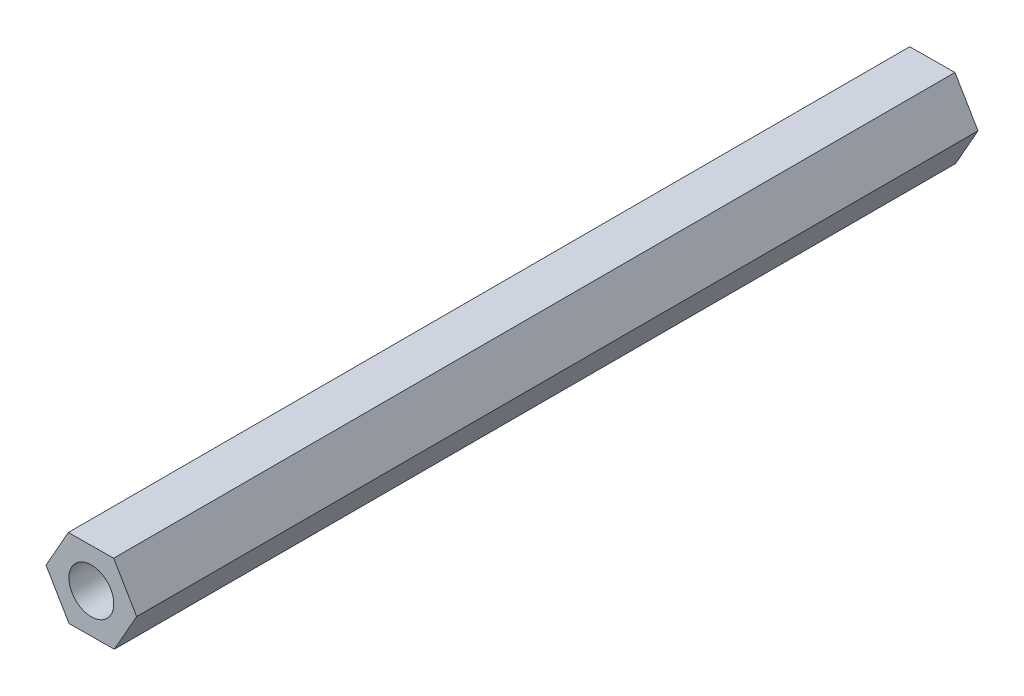
from build123d import *

# Parameters (mm, degrees)
SKETCH_1_R      = 2
EXTRUDE_1_DEPTH = 75


with BuildPart() as part:
    # 草图1 → 凸台-拉伸1 (new body)
    with BuildSketch(Plane.XY):
        Polygon((2.051456248, -3.482077052), (4.041295309, 0.035574699), (1.989839061, 3.517651751), (-2.051456248, 3.482077052), (-4.041295309, -0.035574699), (-1.989839061, -3.517651751), align=None)
        Circle(SKETCH_1_R, mode=Mode.SUBTRACT)
    extrude(amount=EXTRUDE_1_DEPTH)


solid = part.part
